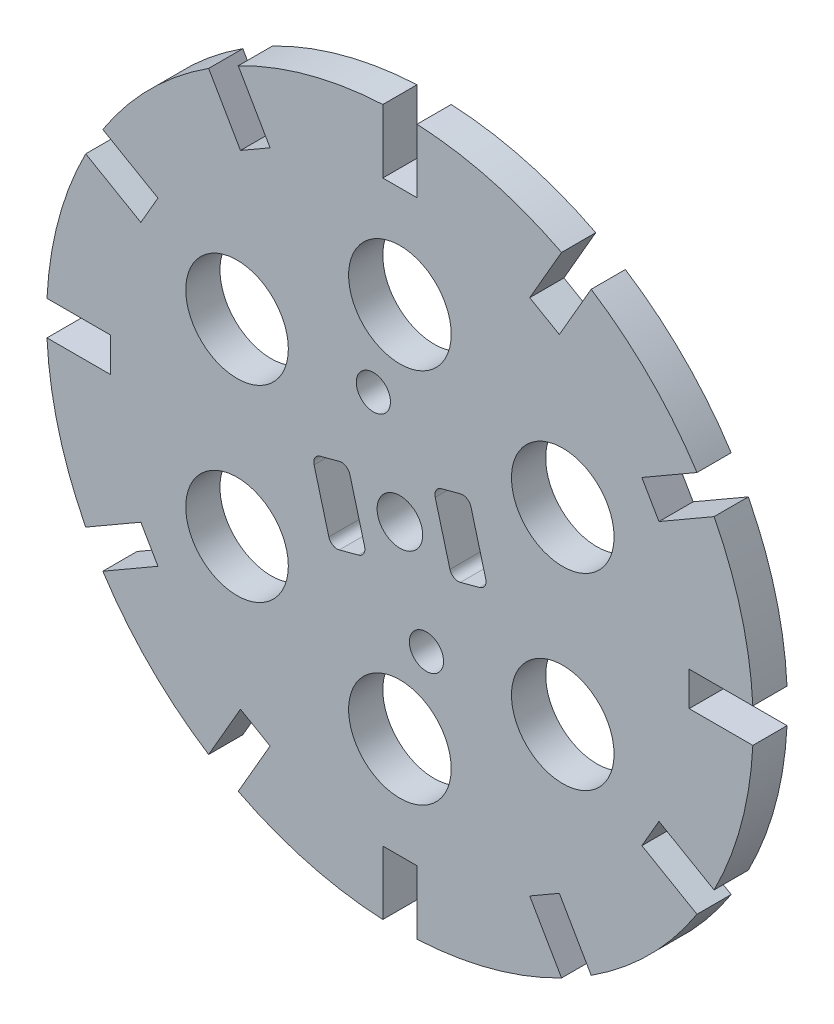
from build123d import *

# Parameters (mm, degrees)
MODEL_R                 = 2
MODEL_R_2               = 1.5
MODEL_R_3               = 4.5
SALIENTE_EXTRUIR1_DEPTH = 3


with BuildPart() as part:
    # Model → Saliente-Extruir1 (new body)
    with BuildSketch(Plane.XY):
        with BuildLine():
            Line((53.427599038, 287.872856798), (56.220729127, 292.710700024))
            ThreePointArc((56.220729127, 292.710700024), (50.061313425, 295.08905988), (43.537923027, 296.109047676))
            Line((43.537923027, 296.109047676), (43.537923027, 290.522787498))
            Line((43.537923027, 290.522787498), (40.537923027, 290.522787498))
            Line((40.537923027, 290.522787498), (40.537923027, 296.109047676))
            ThreePointArc((40.537923027, 296.109047676), (34.014532629, 295.08905988), (27.855116927, 292.710700024))
            Line((27.855116927, 292.710700024), (30.648247016, 287.872856798))
            Line((30.648247016, 287.872856798), (28.050170805, 286.372856798))
            Line((28.050170805, 286.372856798), (25.257040716, 291.210700024))
            ThreePointArc((25.257040716, 291.210700024), (20.11761281, 287.065669482), (15.972582269, 281.926241576))
            Line((15.972582269, 281.926241576), (20.810425495, 279.133111488))
            Line((20.810425495, 279.133111488), (19.310425495, 276.535035276))
            Line((19.310425495, 276.535035276), (14.472582269, 279.328165365))
            ThreePointArc((14.472582269, 279.328165365), (12.094222412, 273.168749664), (11.074234616, 266.645359265))
            Line((11.074234616, 266.645359265), (16.660494794, 266.645359265))
            Line((16.660494794, 266.645359265), (16.660494794, 263.645359265))
            Line((16.660494794, 263.645359265), (11.074234616, 263.645359265))
            ThreePointArc((11.074234616, 263.645359265), (12.094222412, 257.121968867), (14.472582269, 250.962553166))
            Line((14.472582269, 250.962553166), (19.310425495, 253.755683255))
            Line((19.310425495, 253.755683255), (20.810425495, 251.157607043))
            Line((20.810425495, 251.157607043), (15.972582269, 248.364476954))
            ThreePointArc((15.972582269, 248.364476954), (20.11761281, 243.225049049), (25.257040716, 239.080018507))
            Line((25.257040716, 239.080018507), (28.050170805, 243.917861733))
            Line((28.050170805, 243.917861733), (30.648247016, 242.417861733))
            Line((30.648247016, 242.417861733), (27.855116927, 237.580018507))
            ThreePointArc((27.855116927, 237.580018507), (34.014532629, 235.20165865), (40.537923027, 234.181670855))
            Line((40.537923027, 234.181670855), (40.537923027, 239.767931032))
            Line((40.537923027, 239.767931032), (43.537923027, 239.767931032))
            Line((43.537923027, 239.767931032), (43.537923027, 234.181670855))
            ThreePointArc((43.537923027, 234.181670855), (50.061313425, 235.20165865), (56.220729127, 237.580018507))
            Line((56.220729127, 237.580018507), (53.427599038, 242.417861733))
            Line((53.427599038, 242.417861733), (56.025675249, 243.917861733))
            Line((56.025675249, 243.917861733), (58.818805338, 239.080018507))
            ThreePointArc((58.818805338, 239.080018507), (63.958233244, 243.225049049), (68.103263786, 248.364476954))
            Line((68.103263786, 248.364476954), (63.26542056, 251.157607043))
            Line((63.26542056, 251.157607043), (64.76542056, 253.755683255))
            Line((64.76542056, 253.755683255), (69.603263786, 250.962553166))
            ThreePointArc((69.603263786, 250.962553166), (71.981623642, 257.121968867), (73.001611438, 263.645359265))
            Line((73.001611438, 263.645359265), (67.41535126, 263.645359265))
            Line((67.41535126, 263.645359265), (67.41535126, 266.645359265))
            Line((67.41535126, 266.645359265), (73.001611438, 266.645359265))
            ThreePointArc((73.001611438, 266.645359265), (71.981623642, 273.168749664), (69.603263786, 279.328165365))
            Line((69.603263786, 279.328165365), (64.76542056, 276.535035276))
            Line((64.76542056, 276.535035276), (63.26542056, 279.133111488))
            Line((63.26542056, 279.133111488), (68.103263786, 281.926241576))
            ThreePointArc((68.103263786, 281.926241576), (63.958233244, 287.065669482), (58.818805338, 291.210700024))
            Line((58.818805338, 291.210700024), (56.025675249, 286.372856798))
            Line((56.025675249, 286.372856798), (53.427599038, 287.872856798))
        make_face()
        with Locations((42.037923027, 265.145359265)):
            Circle(MODEL_R, mode=Mode.SUBTRACT)
        with Locations((39.708551621, 273.838691702)):
            Circle(MODEL_R_2, mode=Mode.SUBTRACT)
        with Locations((44.367294433, 256.452026829)):
            Circle(MODEL_R_2, mode=Mode.SUBTRACT)
        with Locations((42.037923027, 281.644073382)):
            Circle(MODEL_R_3, mode=Mode.SUBTRACT)
        with Locations((27.749617473, 273.394716324)):
            Circle(MODEL_R_3, mode=Mode.SUBTRACT)
        with Locations((27.749617473, 256.896002207)):
            Circle(MODEL_R_3, mode=Mode.SUBTRACT)
        with Locations((42.037923027, 248.646645149)):
            Circle(MODEL_R_3, mode=Mode.SUBTRACT)
        with Locations((56.326228582, 256.896002207)):
            Circle(MODEL_R_3, mode=Mode.SUBTRACT)
        with Locations((56.326228582, 273.394716324)):
            Circle(MODEL_R_3, mode=Mode.SUBTRACT)
        with BuildLine():
            Line((47.354538273, 269.934589613), (45.664168077, 269.481656284))
            ThreePointArc((45.664168077, 269.481656284), (45.208763308, 269.132211915), (45.133837991, 268.563097631))
            Line((45.133837991, 268.563097631), (46.427933217, 263.733468499))
            ThreePointArc((46.427933217, 263.733468499), (46.777377587, 263.27806373), (47.34649187, 263.203138414))
            Line((47.34649187, 263.203138414), (49.036862066, 263.656071742))
            ThreePointArc((49.036862066, 263.656071742), (49.492266835, 264.005516112), (49.567192152, 264.574630396))
            Line((49.567192152, 264.574630396), (48.273096927, 269.404259527))
            ThreePointArc((48.273096927, 269.404259527), (47.923652557, 269.859664296), (47.354538273, 269.934589613))
        make_face(mode=Mode.SUBTRACT)
        with BuildLine():
            Line((35.038983988, 266.634646788), (36.729354184, 267.087580117))
            ThreePointArc((36.729354184, 267.087580117), (37.298468468, 267.0126548), (37.647912838, 266.557250031))
            Line((37.647912838, 266.557250031), (38.942008063, 261.7276209))
            ThreePointArc((38.942008063, 261.7276209), (38.867082746, 261.158506616), (38.411677977, 260.809062246))
            Line((38.411677977, 260.809062246), (36.721307781, 260.356128917))
            ThreePointArc((36.721307781, 260.356128917), (36.152193497, 260.431054234), (35.802749128, 260.886459003))
            Line((35.802749128, 260.886459003), (34.508653902, 265.716088135))
            ThreePointArc((34.508653902, 265.716088135), (34.583579219, 266.285202419), (35.038983988, 266.634646788))
        make_face(mode=Mode.SUBTRACT)
    extrude(amount=SALIENTE_EXTRUIR1_DEPTH)


solid = part.part
